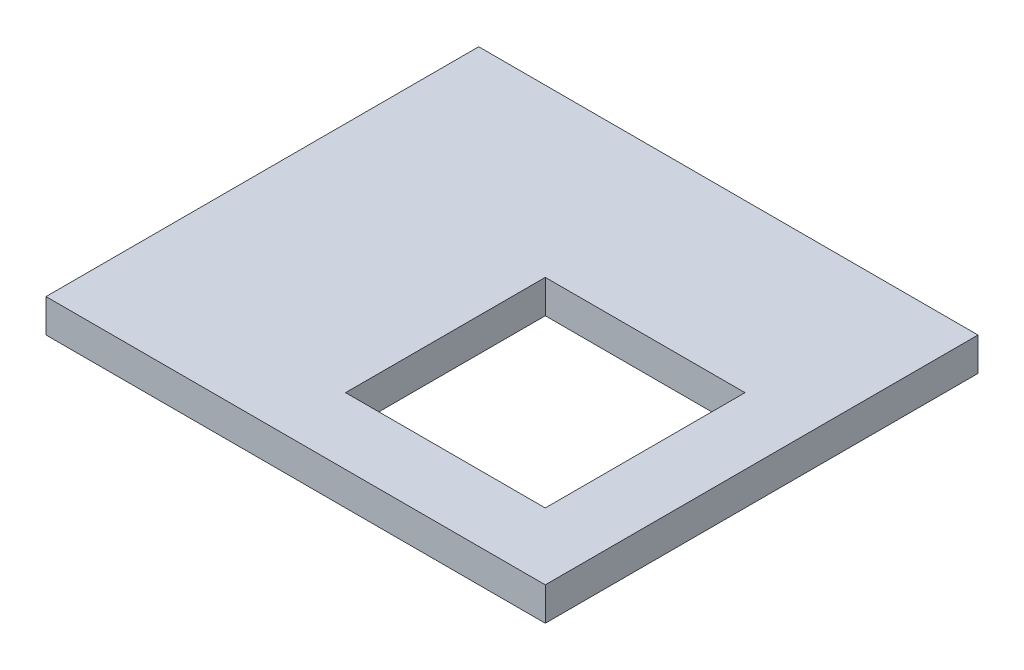
from build123d import *

# Parameters (mm, degrees)
SKETCH_1_W          = 15
SKETCH_1_H          = 13
EXTRUDE_1_DEPTH     = 4
CUT_EXTRUDE_START   = 1
SKETCH_2_W          = 13
SKETCH_2_H          = 15
CUT_EXTRUDE_1_DEPTH = 4
EXTRUDE_START       = 4
SKETCH_3_W          = 15
SKETCH_3_H          = 13
EXTRUDE_3_DEPTH     = 1
CUT_EXTRUDE_START_2 = 5
SKETCH_4_W          = 6
SKETCH_4_H          = 6
CUT_EXTRUDE_2_DEPTH = 1
SKETCH_6_W          = 15
SKETCH_6_H          = 13
CUT_EXTRUDE_4_DEPTH = 4


with BuildPart() as part:
    # 스케치1 → 보스-돌출1 (new body)
    with BuildSketch(Plane(origin=(0, 0, 0), x_dir=(1, 0, 0), z_dir=(0, 1, 0))):
        Rectangle(SKETCH_1_W, SKETCH_1_H)
    extrude(amount=EXTRUDE_1_DEPTH)

    # 스케치2 → 컷-돌출1 (cut)
    with BuildSketch(Plane(origin=(0, 0, 0), x_dir=(1, 0, 0), z_dir=(0, 1, 0)).offset(CUT_EXTRUDE_START)):
        with Locations((0, 2)):
            Rectangle(SKETCH_2_W, SKETCH_2_H)
    extrude(amount=CUT_EXTRUDE_1_DEPTH, mode=Mode.SUBTRACT)

    # 스케치6 → 컷-돌출4 (cut)
    with BuildSketch(Plane.XZ):
        Rectangle(SKETCH_6_W, SKETCH_6_H)
    extrude(amount=-CUT_EXTRUDE_4_DEPTH, mode=Mode.SUBTRACT)


with BuildPart() as body_2:
    # 스케치3 → 보스-돌출3 (new body)
    with BuildSketch(Plane(origin=(0, 0, 0), x_dir=(1, 0, 0), z_dir=(0, 1, 0)).offset(EXTRUDE_START)):
        Rectangle(SKETCH_3_W, SKETCH_3_H)
    extrude(amount=EXTRUDE_3_DEPTH)

    # 스케치4 → 컷-돌출2 (cut)
    with BuildSketch(Plane(origin=(0, 0, 0), x_dir=(1, 0, 0), z_dir=(0, 1, 0)).offset(CUT_EXTRUDE_START_2)):
        with Locations((2.5, -1.5)):
            Rectangle(SKETCH_4_W, SKETCH_4_H)
    extrude(amount=-CUT_EXTRUDE_2_DEPTH, mode=Mode.SUBTRACT)


solid = body_2.part
